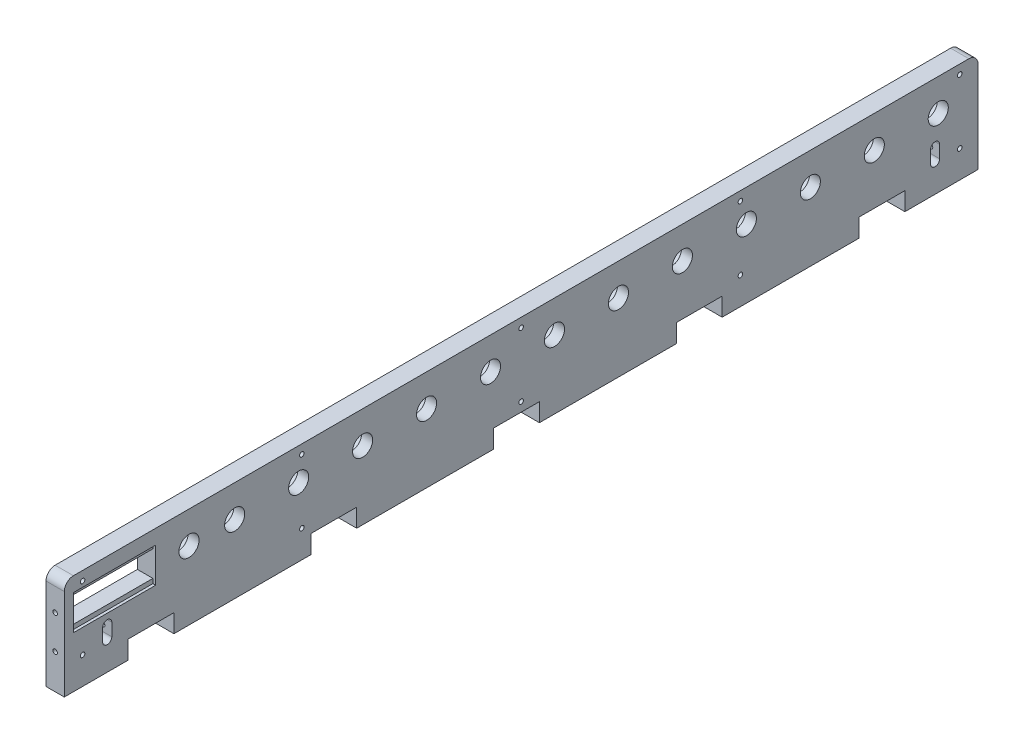
from build123d import *

# Parameters (mm, degrees)
SKETCH1_W                 = 1000
SKETCH1_H                 = 100
SKETCH1_R                 = 11
SKETCH1_W_2               = 90
SKETCH1_H_2               = 28
BOSS_EXTRUDE1_DEPTH       = 20
SKETCH2_W                 = 20
SKETCH2_H                 = 50
SKETCH2_R                 = 4
CUT_EXTRUDE2_DEPTH        = 20
LPATTERN1_COUNT           = 2
LPATTERN1_PITCH           = 220
SKETCH12_R                = 14
CUT_EXTRUDE6_DEPTH        = 8
SKETCH14_W                = 2.5
SKETCH14_H                = 10
SKETCH16_W                = 90
SKETCH16_H                = 5
CUT_EXTRUDE7_DEPTH        = 3
SKETCH17_W                = 90
SKETCH17_H                = 5
CUT_EXTRUDE8_DEPTH        = 3
SKETCH18_R                = 14
CUT_EXTRUDE9_DEPTH        = 8
SKETCH20_W                = 20
SKETCH20_H                = 1000
BOSS_EXTRUDE2_DEPTH       = 10
FILLET1_R                 = 10
FILLET2_R                 = 10
F_5_0MM_DOWEL_HOLE3_D     = 5
F_5_0MM_DOWEL_HOLE3_DEPTH = 10
F_5_0MM_DOWEL_HOLE3_TIP   = 1.502151548
SKETCH27_R                = 2.5
CUT_EXTRUDE10_DEPTH       = 55
CUT_EXTRUDE11_DEPTH       = 1035.26302264
CUT_EXTRUDE12_START       = -70
SKETCH29_R                = 2.5
CUT_EXTRUDE12_DEPTH       = 70
SKETCH30_R                = 2.5
CUT_EXTRUDE13_DEPTH       = 1035.26302264
CUT_EXTRUDE14_REACH       = 1036.263
SKETCH31_W                = 1251.907534991
SKETCH31_H                = 393.114099754
SKETCH32_R                = 4
CUT_EXTRUDE15_DEPTH       = 35


with BuildPart() as part:
    # Sketch1 → Boss-Extrude1 (new body)
    with BuildSketch(Plane(origin=(0, 0, 0), x_dir=(0, 0, -1), z_dir=(1, 0, 0))):
        with Locations((500, 50)):
            Rectangle(SKETCH1_W, SKETCH1_H)
        with Locations((956.5, 75)):
            Circle(SKETCH1_R, mode=Mode.SUBTRACT)
        with Locations((886.5, 75)):
            Circle(SKETCH1_R, mode=Mode.SUBTRACT)
        with Locations((816.5, 75)):
            Circle(SKETCH1_R, mode=Mode.SUBTRACT)
        with Locations((746.5, 75)):
            Circle(SKETCH1_R, mode=Mode.SUBTRACT)
        with Locations((676.5, 75)):
            Circle(SKETCH1_R, mode=Mode.SUBTRACT)
        with Locations((606.5, 75)):
            Circle(SKETCH1_R, mode=Mode.SUBTRACT)
        with Locations((536.5, 75)):
            Circle(SKETCH1_R, mode=Mode.SUBTRACT)
        with Locations((466.5, 75)):
            Circle(SKETCH1_R, mode=Mode.SUBTRACT)
        with Locations((396.5, 75)):
            Circle(SKETCH1_R, mode=Mode.SUBTRACT)
        with Locations((326.5, 75)):
            Circle(SKETCH1_R, mode=Mode.SUBTRACT)
        with Locations((256.5, 75)):
            Circle(SKETCH1_R, mode=Mode.SUBTRACT)
        with Locations((186.5, 75)):
            Circle(SKETCH1_R, mode=Mode.SUBTRACT)
        with Locations((136.5, 75)):
            Circle(SKETCH1_R, mode=Mode.SUBTRACT)
        with Locations((55, 75)):
            Rectangle(SKETCH1_W_2, SKETCH1_H_2, mode=Mode.SUBTRACT)
    extrude(amount=BOSS_EXTRUDE1_DEPTH)

    # Sketch2 → Cut-Extrude2 (cut)
    # profile 1 of 5: a face of its own
    with BuildSketch(Plane.XZ):
        with Locations((10, -895)):
            Rectangle(SKETCH2_W, SKETCH2_H)
        with Locations(Location((10, -910, 0), (0, 0, 270))):
            Circle(SKETCH2_R, mode=Mode.SUBTRACT)
        with Locations(Location((10, -880, 0), (0, 0, 270))):
            Circle(SKETCH2_R, mode=Mode.SUBTRACT)
    # profile 2 of 5: a face of its own
    with BuildSketch(Plane.XZ):
        with Locations((10, -695)):
            Rectangle(SKETCH2_W, SKETCH2_H)
        with Locations(Location((10, -710, 0), (0, 0, 270))):
            Circle(SKETCH2_R, mode=Mode.SUBTRACT)
        with Locations(Location((10, -680, 0), (0, 0, 270))):
            Circle(SKETCH2_R, mode=Mode.SUBTRACT)
    # profile 3 of 5: a face of its own
    with BuildSketch(Plane.XZ):
        with Locations((10, -495)):
            Rectangle(SKETCH2_W, SKETCH2_H)
        with Locations(Location((10, -510, 0), (0, 0, 270))):
            Circle(SKETCH2_R, mode=Mode.SUBTRACT)
        with Locations(Location((10, -480, 0), (0, 0, 270))):
            Circle(SKETCH2_R, mode=Mode.SUBTRACT)
    # profile 4 of 5: a face of its own
    with BuildSketch(Plane.XZ):
        with Locations((10, -295)):
            Rectangle(SKETCH2_W, SKETCH2_H)
        with Locations(Location((10, -310, 0), (0, 0, 270))):
            Circle(SKETCH2_R, mode=Mode.SUBTRACT)
        with Locations(Location((10, -280, 0), (0, 0, 270))):
            Circle(SKETCH2_R, mode=Mode.SUBTRACT)
    # profile 5 of 5: a face of its own
    with BuildSketch(Plane.XZ):
        with Locations((10, -95)):
            Rectangle(SKETCH2_W, SKETCH2_H)
        with Locations(Location((10, -110, 0), (0, 0, 270))):
            Circle(SKETCH2_R, mode=Mode.SUBTRACT)
        with Locations(Location((10, -80, 0), (0, 0, 270))):
            Circle(SKETCH2_R, mode=Mode.SUBTRACT)
    extrude(amount=-CUT_EXTRUDE2_DEPTH, mode=Mode.SUBTRACT)


with BuildPart() as lpattern1_1:
    # LPattern1: pattern copy
    add(part.part.moved(Location(Vector(-1, 0, 0) * (1 * LPATTERN1_PITCH))))

    # Sketch12 → Cut-Extrude6 (cut)
    with BuildSketch(Plane(origin=(-200, 0, 0), x_dir=(0, 0, -1), z_dir=(1, 0, 0))):
        with Locations((956.5, 75)):
            Circle(SKETCH12_R)
        with Locations((886.5, 75)):
            Circle(SKETCH12_R)
        with Locations((816.5, 75)):
            Circle(SKETCH12_R)
        with Locations((746.5, 75)):
            Circle(SKETCH12_R)
        with Locations((676.5, 75)):
            Circle(SKETCH12_R)
        with Locations((606.5, 75)):
            Circle(SKETCH12_R)
        with Locations((536.5, 75)):
            Circle(SKETCH12_R)
        with Locations((466.5, 75)):
            Circle(SKETCH12_R)
        with Locations((396.5, 75)):
            Circle(SKETCH12_R)
        with Locations((326.5, 75)):
            Circle(SKETCH12_R)
        with Locations((256.5, 75)):
            Circle(SKETCH12_R)
        with Locations((186.5, 75)):
            Circle(SKETCH12_R)
        with Locations((136.5, 75)):
            Circle(SKETCH12_R)
    extrude(amount=-CUT_EXTRUDE6_DEPTH, mode=Mode.SUBTRACT)

    # Sketch16 → Cut-Extrude7 (cut)
    with BuildSketch(Plane.ZY.offset(220)):
        with Locations((-55, 91.5)):
            Rectangle(SKETCH16_W, SKETCH16_H)
        with Locations((-55, 58.5)):
            Rectangle(SKETCH16_W, SKETCH16_H)
    extrude(amount=-CUT_EXTRUDE7_DEPTH, mode=Mode.SUBTRACT)


with BuildPart() as part_1:
    add(part.part)

    # Sketch14 → Ø5.0mm Dowel Hole1 (revolve, cut)
    with BuildSketch(Plane(origin=(10, 75, 0), x_dir=(0, -1, 0), z_dir=(1, 0, 0))):
        with Locations((1.25, 5)):
            Rectangle(SKETCH14_W, SKETCH14_H)
    revolve(axis=Axis((10, 75, 6.35), (0, 0, -1)), mode=Mode.SUBTRACT)

    # Sketch17 → Cut-Extrude8 (cut)
    with BuildSketch(Plane(origin=(20, 0, 0), x_dir=(0, 0, -1), z_dir=(1, 0, 0))):
        with Locations((55, 91.5)):
            Rectangle(SKETCH17_W, SKETCH17_H)
        with Locations((55, 58.5)):
            Rectangle(SKETCH17_W, SKETCH17_H)
    extrude(amount=-CUT_EXTRUDE8_DEPTH, mode=Mode.SUBTRACT)

    # Sketch18 → Cut-Extrude9 (cut)
    with BuildSketch(Plane.ZY):
        with Locations((-956.5, 75)):
            Circle(SKETCH18_R)
        with Locations((-886.5, 75)):
            Circle(SKETCH18_R)
        with Locations((-816.5, 75)):
            Circle(SKETCH18_R)
        with Locations((-746.5, 75)):
            Circle(SKETCH18_R)
        with Locations((-676.5, 75)):
            Circle(SKETCH18_R)
        with Locations((-606.5, 75)):
            Circle(SKETCH18_R)
        with Locations((-536.5, 75)):
            Circle(SKETCH18_R)
        with Locations((-466.5, 75)):
            Circle(SKETCH18_R)
        with Locations((-396.5, 75)):
            Circle(SKETCH18_R)
        with Locations((-326.5, 75)):
            Circle(SKETCH18_R)
        with Locations((-256.5, 75)):
            Circle(SKETCH18_R)
        with Locations((-186.5, 75)):
            Circle(SKETCH18_R)
        with Locations((-136.5, 75)):
            Circle(SKETCH18_R)
    extrude(amount=-CUT_EXTRUDE9_DEPTH, mode=Mode.SUBTRACT)

    add(lpattern1_1.part)  # Boss-Extrude2 merges LPattern1_1
    # Sketch20 → Boss-Extrude2 (add)
    with BuildSketch(Plane(origin=(0, 100, 0), x_dir=(1, 0, 0), z_dir=(0, 1, 0))):
        with Locations((-210, 500)):
            Rectangle(SKETCH20_W, SKETCH20_H)
        with Locations((10, 500)):
            Rectangle(SKETCH20_W, SKETCH20_H)
    extrude(amount=BOSS_EXTRUDE2_DEPTH)

    # Fillet1
    fillet1_edges = [part_1.edges().sort_by_distance(p)[0] for p in [
        (-210, 110, 0),
        (-210, 110, -1000),
    ]]
    fillet(fillet1_edges, radius=FILLET1_R)

    # Fillet2
    fillet2_edges = [part_1.edges().sort_by_distance(p)[0] for p in [
        (10, 110, 0),
        (10, 110, -1000),
    ]]
    fillet(fillet2_edges, radius=FILLET2_R)

    # Ø5.0mm Dowel Hole3
    with Locations(Plane(origin=(-210, 74.987891575, 0), x_dir=(1, 0, 0), z_dir=(0, 0, 1))):
        with Locations((0, 0)):
            Hole(F_5_0MM_DOWEL_HOLE3_D / 2, depth=F_5_0MM_DOWEL_HOLE3_DEPTH)
            with Locations((0, 0, -(F_5_0MM_DOWEL_HOLE3_DEPTH + F_5_0MM_DOWEL_HOLE3_TIP / 2))):  # 118° drill point
                Cone(0, F_5_0MM_DOWEL_HOLE3_D / 2, F_5_0MM_DOWEL_HOLE3_TIP, mode=Mode.SUBTRACT)

    # Sketch27 → Cut-Extrude10 (cut)
    with BuildSketch(Plane.XY):
        with Locations((-210, 38)):
            Circle(SKETCH27_R)
        with Locations((10, 38)):
            Circle(SKETCH27_R)
    extrude(amount=-CUT_EXTRUDE10_DEPTH, mode=Mode.SUBTRACT)

    # Sketch28 → Cut-Extrude11 (cut, through all)
    with BuildSketch(Plane.ZY.offset(220)):
        with BuildLine():
            Line((-42, 44.831263619), (-42, 31.168736381))
            ThreePointArc((-42, 31.168736381), (-47, 26.168736381), (-52, 31.168736381))
            Line((-52, 31.168736381), (-52, 44.831263619))
            ThreePointArc((-52, 44.831263619), (-47, 49.831263619), (-42, 44.831263619))
        make_face()
        with BuildLine():
            Line((-958, 44.831263619), (-958, 31.168736381))
            ThreePointArc((-958, 31.168736381), (-953, 26.168736381), (-948, 31.168736381))
            Line((-948, 31.168736381), (-948, 44.831263619))
            ThreePointArc((-948, 44.831263619), (-953, 49.831263619), (-958, 44.831263619))
        make_face()
    extrude(amount=-CUT_EXTRUDE11_DEPTH, mode=Mode.SUBTRACT)

    # Sketch29 → Cut-Extrude12 (cut)
    with BuildSketch(Plane(origin=(0, 0, -1000), x_dir=(-1, 0, 0), z_dir=(0, 0, -1)).offset(CUT_EXTRUDE12_START)):
        with Locations(Location((-10, 38, 0), (0, 0, 180))):
            Circle(SKETCH29_R)
        with Locations(Location((210, 38, 0), (0, 0, 180))):
            Circle(SKETCH29_R)
    extrude(amount=CUT_EXTRUDE12_DEPTH, mode=Mode.SUBTRACT)

    # Sketch30 → Cut-Extrude13 (cut, through all)
    with BuildSketch(Plane(origin=(20, 0, 0), x_dir=(0, 0, -1), z_dir=(1, 0, 0))):
        with Locations((500, 30)):
            Circle(SKETCH30_R)
        with Locations((20, 30)):
            Circle(SKETCH30_R)
        with Locations((20, 100)):
            Circle(SKETCH30_R)
        with Locations((500, 100)):
            Circle(SKETCH30_R)
        with Locations((980, 100)):
            Circle(SKETCH30_R)
        with Locations((980, 30)):
            Circle(SKETCH30_R)
        with Locations((260, 100)):
            Circle(SKETCH30_R)
        with Locations((740, 100)):
            Circle(SKETCH30_R)
        with Locations((740, 30)):
            Circle(SKETCH30_R)
        with Locations((260, 30)):
            Circle(SKETCH30_R)
    extrude(amount=-CUT_EXTRUDE13_DEPTH, mode=Mode.SUBTRACT)

    # Sketch31 → Cut-Extrude14 (cut, up to next)
    with BuildSketch(Plane.ZY.offset(220), mode=Mode.PRIVATE) as cut_extrude14_sk1:
        with Locations((-530.819455446, 0)):
            Rectangle(SKETCH31_W, SKETCH31_H)
    cut_extrude14_tool1 = extrude(cut_extrude14_sk1.sketch, amount=-CUT_EXTRUDE14_REACH, mode=Mode.PRIVATE) & part_1.part
    add(cut_extrude14_tool1.solids().sort_by_distance((-220, 0, -530.819455))[0], mode=Mode.SUBTRACT)

    # Sketch32 → Cut-Extrude15 (cut)
    with BuildSketch(Plane.XZ):
        with Locations(Location((10, -310, 0), (0, 0, 270))):
            Circle(SKETCH32_R)
        with Locations(Location((10, -280, 0), (0, 0, 270))):
            Circle(SKETCH32_R)
        with Locations(Location((10, -110, 0), (0, 0, 270))):
            Circle(SKETCH32_R)
        with Locations(Location((10, -80, 0), (0, 0, 270))):
            Circle(SKETCH32_R)
        with Locations(Location((10, -480, 0), (0, 0, 270))):
            Circle(SKETCH32_R)
        with Locations(Location((10, -510, 0), (0, 0, 270))):
            Circle(SKETCH32_R)
        with Locations(Location((10, -680, 0), (0, 0, 270))):
            Circle(SKETCH32_R)
        with Locations(Location((10, -710, 0), (0, 0, 270))):
            Circle(SKETCH32_R)
        with Locations(Location((10, -880, 0), (0, 0, 270))):
            Circle(SKETCH32_R)
        with Locations(Location((10, -910, 0), (0, 0, 270))):
            Circle(SKETCH32_R)
    extrude(amount=-CUT_EXTRUDE15_DEPTH, mode=Mode.SUBTRACT)


solid = part_1.part
